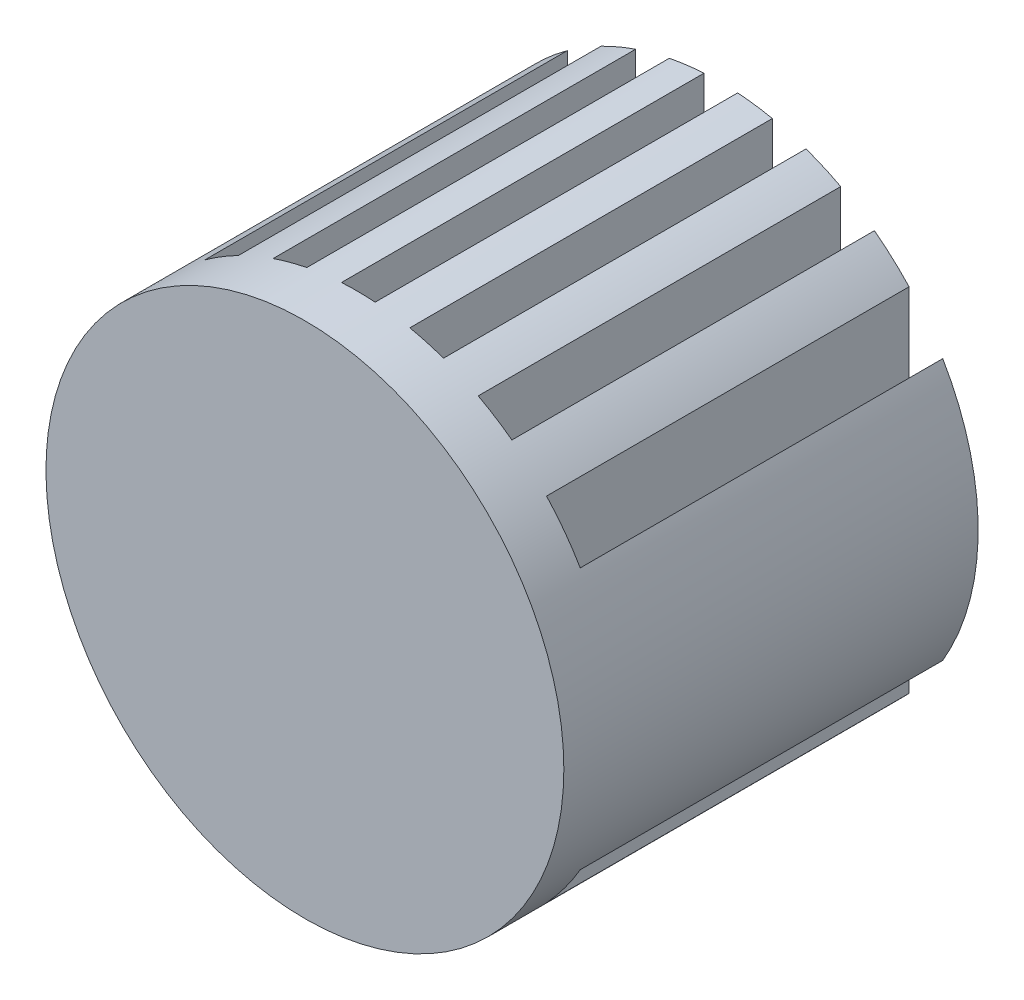
from build123d import *

# Parameters (mm, degrees)
ESQUISSE1_R             = 31.75
BOSS_EXTRU_1_DEPTH      = 50.8
ESQUISSE3_W             = 4.13004
ESQUISSE3_H             = 63.5
ENL_V_MAT_EXTRU_1_DEPTH = 44.45


with BuildPart() as part:
    # Esquisse1 → Boss.-Extru.1 (new body)
    with BuildSketch(Plane.XY):
        Circle(ESQUISSE1_R)
    extrude(amount=BOSS_EXTRU_1_DEPTH)

    # Esquisse3 → Enlèv. mat.-Extru.1 (cut)
    with BuildSketch(Plane(origin=(0, 0, 0), x_dir=(-1, 0, 0), z_dir=(0, 0, -1))):
        with Locations((-16.96212, 0)):
            Rectangle(ESQUISSE3_W, ESQUISSE3_H)
        with Locations((-25.34412, 0)):
            Rectangle(ESQUISSE3_W, ESQUISSE3_H)
        with Locations((-8.58012, 0)):
            Rectangle(ESQUISSE3_W, ESQUISSE3_H)
        with Locations((-0.19812, 0)):
            Rectangle(ESQUISSE3_W, ESQUISSE3_H)
        with Locations((8.18388, 0)):
            Rectangle(ESQUISSE3_W, ESQUISSE3_H)
        with Locations((16.56588, 0)):
            Rectangle(ESQUISSE3_W, ESQUISSE3_H)
        with Locations((24.94788, 0)):
            Rectangle(ESQUISSE3_W, ESQUISSE3_H)
    extrude(amount=-ENL_V_MAT_EXTRU_1_DEPTH, mode=Mode.SUBTRACT)


solid = part.part
